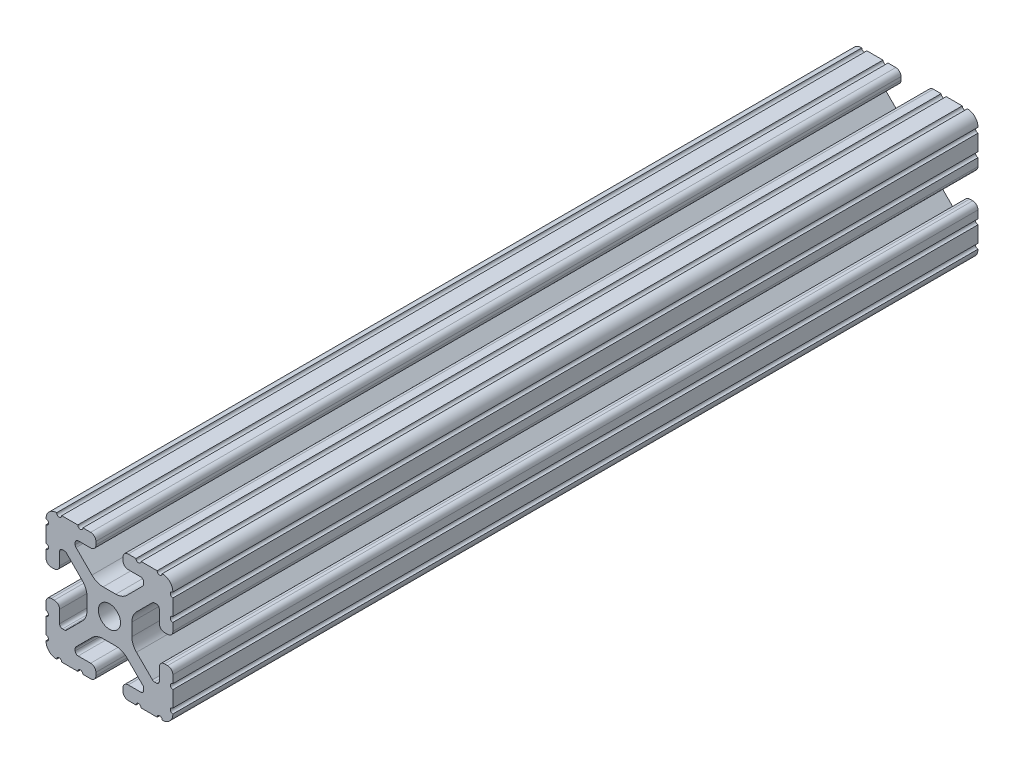
from build123d import *

# Parameters (mm, degrees)
SKETCH1_R           = 3.3274
BOSS_EXTRUDE1_DEPTH = 241.808


with BuildPart() as part:
    # Sketch1 → Boss-Extrude1 (new body)
    with BuildSketch(Plane.XY):
        with BuildLine():
            Line((-14.097, 10.287), (-13.528918, 10.287))
            ThreePointArc((-13.528918, 10.287), (-13.188712428, 10.219328904), (-12.900300071, 10.026617928))
            Line((-12.900300071, 10.026617928), (-8.129198975, 5.255516832))
            ThreePointArc((-8.129198975, 5.255516832), (-7.09957176, 3.71457081), (-6.738014764, 1.896901043))
            Line((-6.738014764, 1.896901043), (-6.738014764, -1.896901043))
            ThreePointArc((-6.738014764, -1.896901043), (-7.09957176, -3.71457081), (-8.129198975, -5.255516832))
            Line((-8.129198975, -5.255516832), (-12.900300071, -10.026617928))
            ThreePointArc((-12.900300071, -10.026617928), (-13.188712428, -10.219328904), (-13.528918, -10.287))
            Line((-13.528918, -10.287), (-14.097, -10.287))
            ThreePointArc((-14.097, -10.287), (-14.725617928, -10.026617928), (-14.986, -9.398))
            Line((-14.986, -9.398), (-14.986, -5.6388))
            ThreePointArc((-14.986, -5.6388), (-15.447248241, -4.525248241), (-16.5608, -4.064))
            Line((-16.5608, -4.064), (-17.4752, -4.064))
            ThreePointArc((-17.4752, -4.064), (-18.588751759, -4.525248241), (-19.05, -5.6388))
            Line((-19.05, -5.6388), (-19.05, -7.9756))
            ThreePointArc((-19.05, -7.9756), (-18.288, -8.7376), (-19.05, -9.4996))
            Line((-19.05, -9.4996), (-19.05, -14.3256))
            ThreePointArc((-19.05, -14.3256), (-18.288, -15.0876), (-19.05, -15.8496))
            Line((-19.05, -15.8496), (-19.05, -15.875))
            ThreePointArc((-19.05, -15.875), (-18.12006403, -18.12006403), (-15.875, -19.05))
            Line((-15.875, -19.05), (-15.8496, -19.05))
            ThreePointArc((-15.8496, -19.05), (-15.0876, -18.288), (-14.3256, -19.05))
            Line((-14.3256, -19.05), (-9.4996, -19.05))
            ThreePointArc((-9.4996, -19.05), (-8.7376, -18.288), (-7.9756, -19.05))
            Line((-7.9756, -19.05), (-5.6388, -19.05))
            ThreePointArc((-5.6388, -19.05), (-4.525248241, -18.588751759), (-4.064, -17.4752))
            Line((-4.064, -17.4752), (-4.064, -16.5608))
            ThreePointArc((-4.064, -16.5608), (-4.525248241, -15.447248241), (-5.6388, -14.986))
            Line((-5.6388, -14.986), (-9.398, -14.986))
            ThreePointArc((-9.398, -14.986), (-10.026617928, -14.725617928), (-10.287, -14.097))
            Line((-10.287, -14.097), (-10.287, -13.528918))
            ThreePointArc((-10.287, -13.528918), (-10.219328904, -13.188712428), (-10.026617928, -12.900300071))
            Line((-10.026617928, -12.900300071), (-5.255516832, -8.129198975))
            ThreePointArc((-5.255516832, -8.129198975), (-3.71457081, -7.09957176), (-1.896901043, -6.738014764))
            Line((-1.896901043, -6.738014764), (1.896901043, -6.738014764))
            ThreePointArc((1.896901043, -6.738014764), (3.71457081, -7.09957176), (5.255516832, -8.129198975))
            Line((5.255516832, -8.129198975), (10.026617928, -12.900300071))
            ThreePointArc((10.026617928, -12.900300071), (10.219328904, -13.188712428), (10.287, -13.528918))
            Line((10.287, -13.528918), (10.287, -14.097))
            ThreePointArc((10.287, -14.097), (10.026617928, -14.725617928), (9.398, -14.986))
            Line((9.398, -14.986), (5.6388, -14.986))
            ThreePointArc((5.6388, -14.986), (4.525248241, -15.447248241), (4.064, -16.5608))
            Line((4.064, -16.5608), (4.064, -17.4752))
            ThreePointArc((4.064, -17.4752), (4.525248241, -18.588751759), (5.6388, -19.05))
            Line((5.6388, -19.05), (7.9756, -19.05))
            ThreePointArc((7.9756, -19.05), (8.7376, -18.288), (9.4996, -19.05))
            Line((9.4996, -19.05), (14.3256, -19.05))
            ThreePointArc((14.3256, -19.05), (15.0876, -18.288), (15.8496, -19.05))
            Line((15.8496, -19.05), (15.875, -19.05))
            ThreePointArc((15.875, -19.05), (18.12006403, -18.12006403), (19.05, -15.875))
            Line((19.05, -15.875), (19.05, -15.8496))
            ThreePointArc((19.05, -15.8496), (18.288, -15.0876), (19.05, -14.3256))
            Line((19.05, -14.3256), (19.05, -9.4996))
            ThreePointArc((19.05, -9.4996), (18.288, -8.7376), (19.05, -7.9756))
            Line((19.05, -7.9756), (19.05, -5.6388))
            ThreePointArc((19.05, -5.6388), (18.588751759, -4.525248241), (17.4752, -4.064))
            Line((17.4752, -4.064), (16.5608, -4.064))
            ThreePointArc((16.5608, -4.064), (15.447248241, -4.525248241), (14.986, -5.6388))
            Line((14.986, -5.6388), (14.986, -9.398))
            ThreePointArc((14.986, -9.398), (14.725617928, -10.026617928), (14.097, -10.287))
            Line((14.097, -10.287), (13.528918, -10.287))
            ThreePointArc((13.528918, -10.287), (13.188712428, -10.219328904), (12.900300071, -10.026617928))
            Line((12.900300071, -10.026617928), (8.129198975, -5.255516832))
            ThreePointArc((8.129198975, -5.255516832), (7.09957176, -3.71457081), (6.738014764, -1.896901043))
            Line((6.738014764, -1.896901043), (6.738014764, 1.896901043))
            ThreePointArc((6.738014764, 1.896901043), (7.09957176, 3.71457081), (8.129198975, 5.255516832))
            Line((8.129198975, 5.255516832), (12.900300071, 10.026617928))
            ThreePointArc((12.900300071, 10.026617928), (13.188712428, 10.219328904), (13.528918, 10.287))
            Line((13.528918, 10.287), (14.097, 10.287))
            ThreePointArc((14.097, 10.287), (14.725617928, 10.026617928), (14.986, 9.398))
            Line((14.986, 9.398), (14.986, 5.6388))
            ThreePointArc((14.986, 5.6388), (15.447248241, 4.525248241), (16.5608, 4.064))
            Line((16.5608, 4.064), (17.4752, 4.064))
            ThreePointArc((17.4752, 4.064), (18.588751759, 4.525248241), (19.05, 5.6388))
            Line((19.05, 5.6388), (19.05, 7.9756))
            ThreePointArc((19.05, 7.9756), (18.288, 8.7376), (19.05, 9.4996))
            Line((19.05, 9.4996), (19.05, 14.3256))
            ThreePointArc((19.05, 14.3256), (18.288, 15.0876), (19.05, 15.8496))
            Line((19.05, 15.8496), (19.05, 15.875))
            ThreePointArc((19.05, 15.875), (18.12006403, 18.12006403), (15.875, 19.05))
            Line((15.875, 19.05), (15.8496, 19.05))
            ThreePointArc((15.8496, 19.05), (15.0876, 18.288), (14.3256, 19.05))
            Line((14.3256, 19.05), (9.4996, 19.05))
            ThreePointArc((9.4996, 19.05), (8.7376, 18.288), (7.9756, 19.05))
            Line((7.9756, 19.05), (5.6388, 19.05))
            ThreePointArc((5.6388, 19.05), (4.525248241, 18.588751759), (4.064, 17.4752))
            Line((4.064, 17.4752), (4.064, 16.5608))
            ThreePointArc((4.064, 16.5608), (4.525248241, 15.447248241), (5.6388, 14.986))
            Line((5.6388, 14.986), (9.398, 14.986))
            ThreePointArc((9.398, 14.986), (10.026617928, 14.725617928), (10.287, 14.097))
            Line((10.287, 14.097), (10.287, 13.528918))
            ThreePointArc((10.287, 13.528918), (10.219328904, 13.188712428), (10.026617928, 12.900300071))
            Line((10.026617928, 12.900300071), (5.255516832, 8.129198975))
            ThreePointArc((5.255516832, 8.129198975), (3.71457081, 7.09957176), (1.896901043, 6.738014764))
            Line((1.896901043, 6.738014764), (-1.896901043, 6.738014764))
            ThreePointArc((-1.896901043, 6.738014764), (-3.71457081, 7.09957176), (-5.255516832, 8.129198975))
            Line((-5.255516832, 8.129198975), (-10.026617928, 12.900300071))
            ThreePointArc((-10.026617928, 12.900300071), (-10.219328904, 13.188712428), (-10.287, 13.528918))
            Line((-10.287, 13.528918), (-10.287, 14.097))
            ThreePointArc((-10.287, 14.097), (-10.026617928, 14.725617928), (-9.398, 14.986))
            Line((-9.398, 14.986), (-5.6388, 14.986))
            ThreePointArc((-5.6388, 14.986), (-4.525248241, 15.447248241), (-4.064, 16.5608))
            Line((-4.064, 16.5608), (-4.064, 17.4752))
            ThreePointArc((-4.064, 17.4752), (-4.525248241, 18.588751759), (-5.6388, 19.05))
            Line((-5.6388, 19.05), (-7.9756, 19.05))
            ThreePointArc((-7.9756, 19.05), (-8.7376, 18.288), (-9.4996, 19.05))
            Line((-9.4996, 19.05), (-14.3256, 19.05))
            ThreePointArc((-14.3256, 19.05), (-15.0876, 18.288), (-15.8496, 19.05))
            Line((-15.8496, 19.05), (-15.875, 19.05))
            ThreePointArc((-15.875, 19.05), (-18.12006403, 18.12006403), (-19.05, 15.875))
            Line((-19.05, 15.875), (-19.05, 15.8496))
            ThreePointArc((-19.05, 15.8496), (-18.288, 15.0876), (-19.05, 14.3256))
            Line((-19.05, 14.3256), (-19.05, 9.4996))
            ThreePointArc((-19.05, 9.4996), (-18.288, 8.7376), (-19.05, 7.9756))
            Line((-19.05, 7.9756), (-19.05, 5.6388))
            ThreePointArc((-19.05, 5.6388), (-18.588751759, 4.525248241), (-17.4752, 4.064))
            Line((-17.4752, 4.064), (-16.5608, 4.064))
            ThreePointArc((-16.5608, 4.064), (-15.447248241, 4.525248241), (-14.986, 5.6388))
            Line((-14.986, 5.6388), (-14.986, 9.398))
            ThreePointArc((-14.986, 9.398), (-14.725617928, 10.026617928), (-14.097, 10.287))
        make_face()
        Circle(SKETCH1_R, mode=Mode.SUBTRACT)
    extrude(amount=BOSS_EXTRUDE1_DEPTH)


solid = part.part
